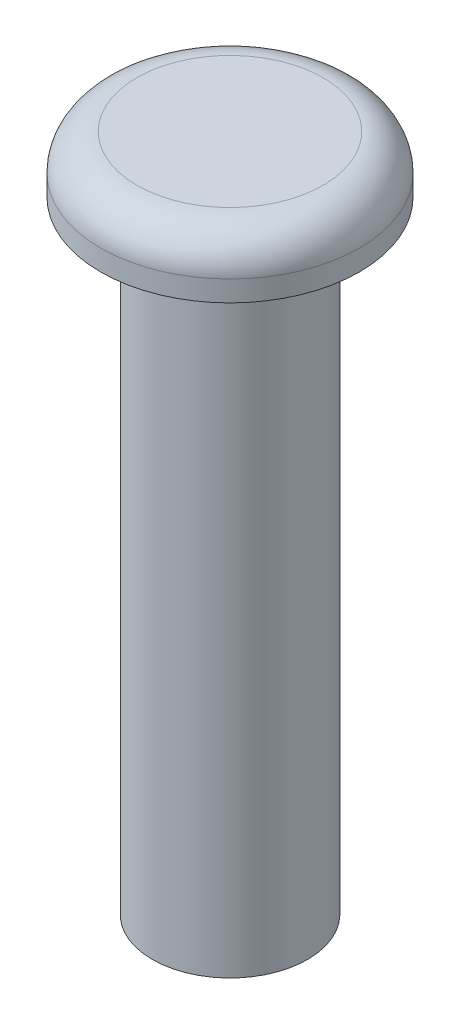
from build123d import *

# Parameters (mm, degrees)
SKETCH_1_R      = 1.5
EXTRUDE_1_DEPTH = 12
SKETCH_2_R      = 2.5
EXTRUDE_2_DEPTH = 1.1
FILLET_1_R      = 0.7


with BuildPart() as part:
    # 草图1 → 凸台-拉伸1 (new body)
    with BuildSketch(Plane(origin=(0, 0, 0), x_dir=(1, 0, 0), z_dir=(0, 1, 0))):
        with Locations(Location((0, 0, 0), (0, 0, 270))):
            Circle(SKETCH_1_R)
    extrude(amount=EXTRUDE_1_DEPTH)

    # 草图2 → 凸台-拉伸2 (add)
    with BuildSketch(Plane(origin=(0, 12, 0), x_dir=(1, 0, 0), z_dir=(0, 1, 0))):
        with Locations(Location((0, 0, 0), (0, 0, 270))):
            Circle(SKETCH_2_R)
    extrude(amount=EXTRUDE_2_DEPTH)

    # 圆角1
    fillet_1_edges = [part.edges().sort_by_distance(p)[0] for p in [
        (0, 13.1, -2.5),
    ]]
    fillet(fillet_1_edges, radius=FILLET_1_R)


solid = part.part
